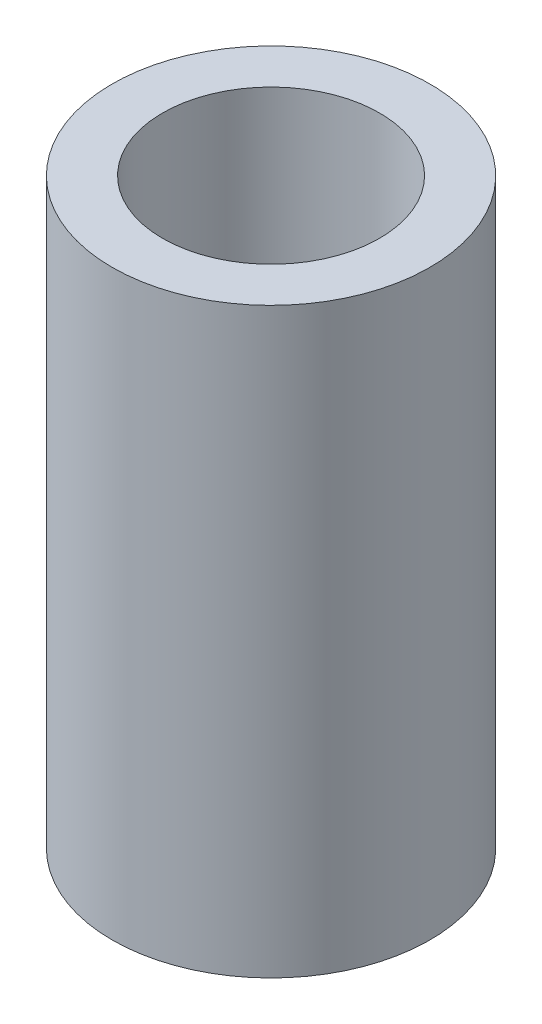
from build123d import *

# Parameters (mm, degrees)
SKETCH2_R           = 6
BOSS_EXTRUDE1_DEPTH = 22
SKETCH3_R           = 4.1
CUT_EXTRUDE1_DEPTH  = 10
SKETCH4_R           = 2.1
CUT_EXTRUDE2_DEPTH  = 10


with BuildPart() as part:
    # Sketch2 → Boss-Extrude1 (new body)
    with BuildSketch(Plane(origin=(0, 0, 0), x_dir=(1, 0, 0), z_dir=(0, 1, 0))):
        with Locations(Location((0, 0, 0), (0, 0, 270))):
            Circle(SKETCH2_R)
    extrude(amount=BOSS_EXTRUDE1_DEPTH)

    # Sketch3 → Cut-Extrude1 (cut)
    with BuildSketch(Plane(origin=(0, 22, 0), x_dir=(1, 0, 0), z_dir=(0, 1, 0))):
        with Locations(Location((0, 0, 0), (0, 0, 270))):
            Circle(SKETCH3_R)
    extrude(amount=-CUT_EXTRUDE1_DEPTH, mode=Mode.SUBTRACT)

    # Sketch4 → Cut-Extrude2 (cut)
    with BuildSketch(Plane(origin=(0, 12, 0), x_dir=(1, 0, 0), z_dir=(0, 1, 0))):
        with Locations(Location((0, 0, 0), (0, 0, 270))):
            Circle(SKETCH4_R)
    extrude(amount=-CUT_EXTRUDE2_DEPTH, mode=Mode.SUBTRACT)


solid = part.part
